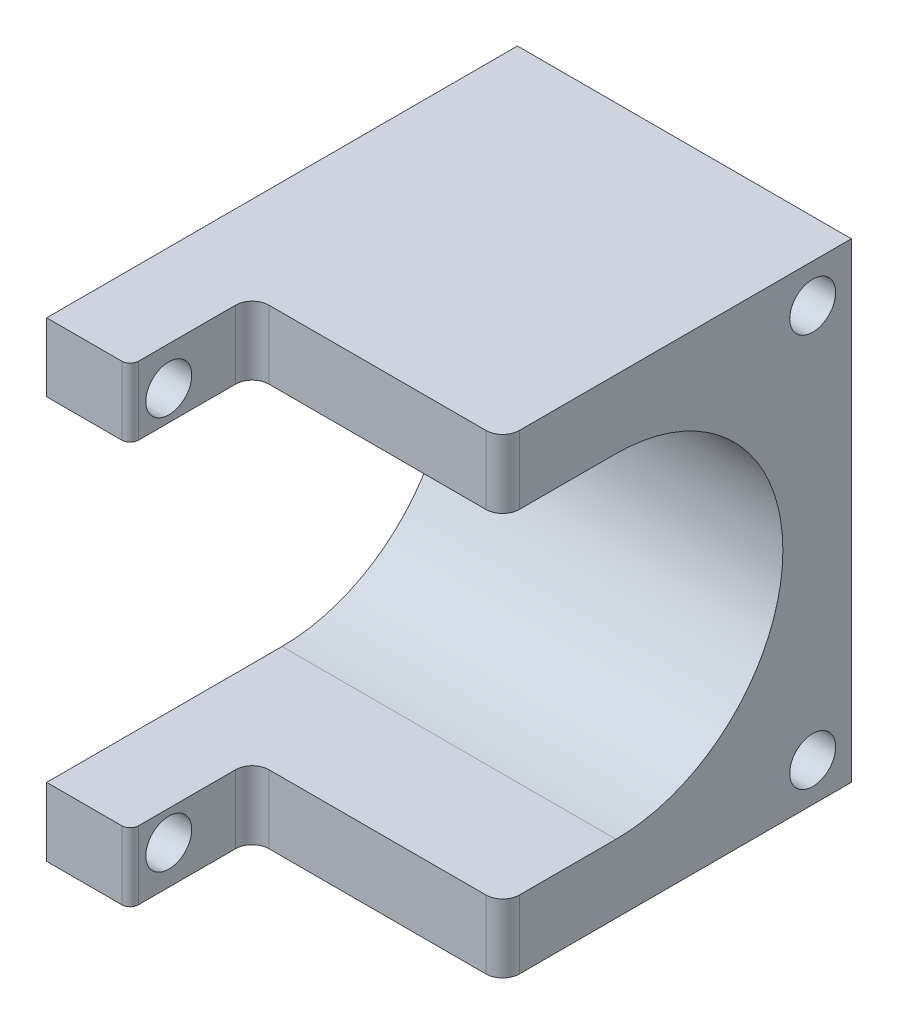
from build123d import *

# Parameters (mm, degrees)
SKETCH1_W           = 56.4
SKETCH1_H           = 56.4
BOSS_EXTRUDE1_DEPTH = 40
SKETCH2_R           = 2.75
CUT_EXTRUDE1_DEPTH  = 79.317122537
CUT_EXTRUDE3_DEPTH  = 79.317122537
SKETCH5_W           = 14.63
SKETCH5_H           = 8.2
CUT_EXTRUDE4_DEPTH  = 30
FILLET1_R           = 2
FILLET2_R           = 2
FILLET3_R           = 1


with BuildPart() as part:
    # Sketch1 → Boss-Extrude1 (new body)
    with BuildSketch(Plane(origin=(0, 0, 0), x_dir=(0, 0, -1), z_dir=(1, 0, 0))):
        with Locations((10.777070064, -26.703184713)):
            Rectangle(SKETCH1_W, SKETCH1_H)
    extrude(amount=BOSS_EXTRUDE1_DEPTH)

    # Sketch2 → Cut-Extrude1 (cut, through all)
    with BuildSketch(Plane(origin=(40, 0, 0), x_dir=(0, 0, -1), z_dir=(1, 0, 0))):
        with Locations((-12.792929936, -3.133184713)):
            Circle(SKETCH2_R)
        with Locations(Location((-12.792929936, -50.273184713, 0), (0, 0, 180))):
            Circle(SKETCH2_R)
        with Locations(Location((34.347070064, -3.133184713, 0), (0, 0, 180))):
            Circle(SKETCH2_R)
        with Locations((34.347070064, -50.273184713)):
            Circle(SKETCH2_R)
    extrude(amount=-CUT_EXTRUDE1_DEPTH, mode=Mode.SUBTRACT)

    # Sketch4 → Cut-Extrude3 (cut, through all)
    with BuildSketch(Plane(origin=(40, 0, 0), x_dir=(0, 0, -1), z_dir=(1, 0, 0))):
        with BuildLine():
            Line((10.777070064, -6.703184713), (-17.422929936, -6.703184713))
            Line((-17.422929936, -6.703184713), (-17.422929936, -46.703184713))
            Line((-17.422929936, -46.703184713), (10.777070064, -46.703184713))
            ThreePointArc((10.777070064, -46.703184713), (30.777070064, -26.703184713), (10.777070064, -6.703184713))
        make_face()
    extrude(amount=-CUT_EXTRUDE3_DEPTH, mode=Mode.SUBTRACT)

    # Sketch5 → Cut-Extrude4 (cut)
    with BuildSketch(Plane(origin=(40, 0, 0), x_dir=(0, 0, -1), z_dir=(1, 0, 0))):
        with Locations((-10.107929936, -2.603184713)):
            Rectangle(SKETCH5_W, SKETCH5_H)
        with Locations((-10.107929936, -50.803184713)):
            Rectangle(SKETCH5_W, SKETCH5_H)
    extrude(amount=-CUT_EXTRUDE4_DEPTH, mode=Mode.SUBTRACT)

    # Fillet1
    fillet1_edges = [part.edges().sort_by_distance(p)[0] for p in [
        (10, -2.603184713, 2.792929936),
        (10, -50.803184713, 2.792929936),
    ]]
    fillet(fillet1_edges, radius=FILLET1_R)

    # Fillet2
    fillet2_edges = [part.edges().sort_by_distance(p)[0] for p in [
        (40, -2.603184713, 2.792929936),
        (40, -50.803184713, 2.792929936),
    ]]
    fillet(fillet2_edges, radius=FILLET2_R)

    # Fillet3
    fillet3_edges = [part.edges().sort_by_distance(p)[0] for p in [
        (10, -2.603184713, 17.422929936),
        (10, -50.803184713, 17.422929936),
    ]]
    fillet(fillet3_edges, radius=FILLET3_R)


solid = part.part
